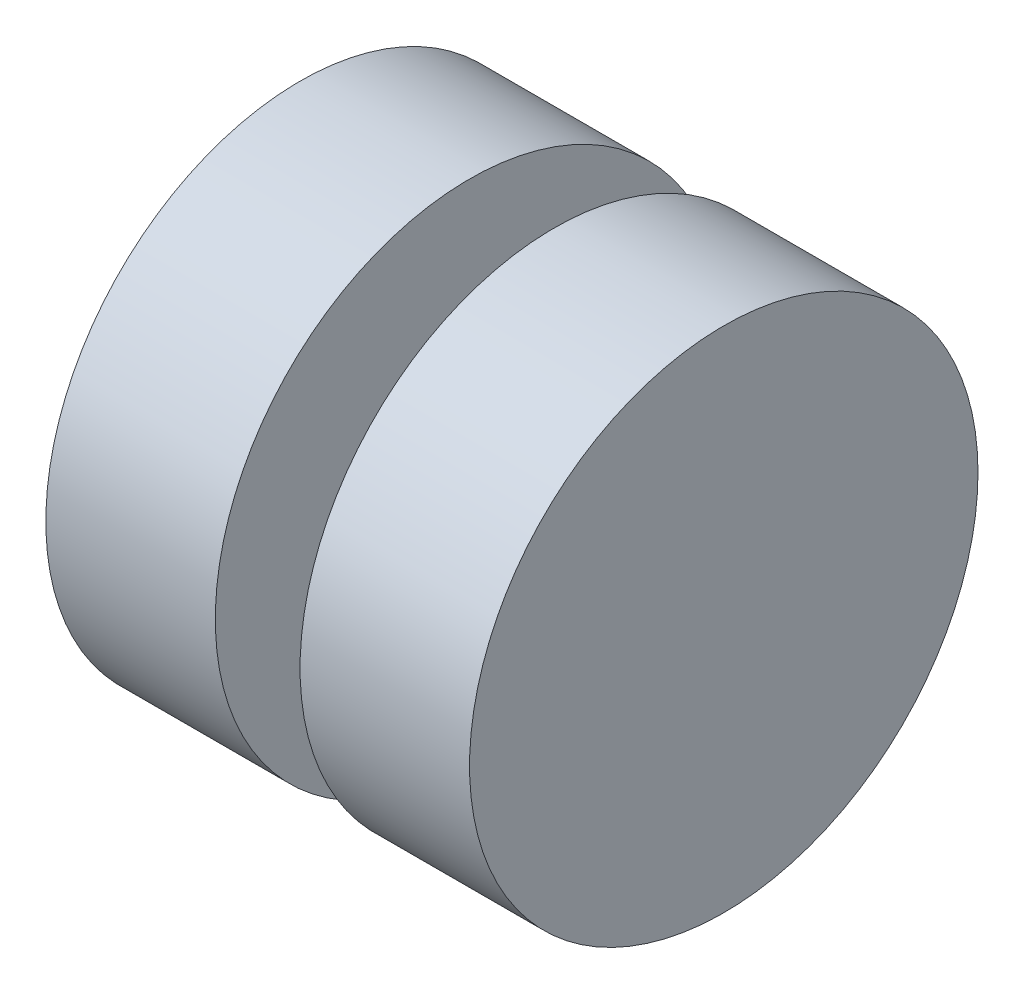
from build123d import *

# Parameters (mm, degrees)
CROQUIS1_R              = 15
SALIENTE_EXTRUIR1_DEPTH = 10
CROQUIS2_R              = 5
SALIENTE_EXTRUIR2_DEPTH = 5
CROQUIS3_R              = 15
SALIENTE_EXTRUIR3_DEPTH = 10


with BuildPart() as part:
    # Croquis1 → Saliente-Extruir1 (new body)
    with BuildSketch(Plane(origin=(0, 0, 0), x_dir=(0, 0, -1), z_dir=(1, 0, 0))):
        Circle(CROQUIS1_R)
    extrude(amount=SALIENTE_EXTRUIR1_DEPTH)

    # Croquis2 → Saliente-Extruir2 (add)
    with BuildSketch(Plane(origin=(10, 0, 0), x_dir=(0, 0, -1), z_dir=(1, 0, 0))):
        Circle(CROQUIS2_R)
    extrude(amount=SALIENTE_EXTRUIR2_DEPTH)

    # Croquis3 → Saliente-Extruir3 (add)
    with BuildSketch(Plane(origin=(15, 0, 0), x_dir=(0, 0, -1), z_dir=(1, 0, 0))):
        Circle(CROQUIS3_R)
    extrude(amount=SALIENTE_EXTRUIR3_DEPTH)


solid = part.part
